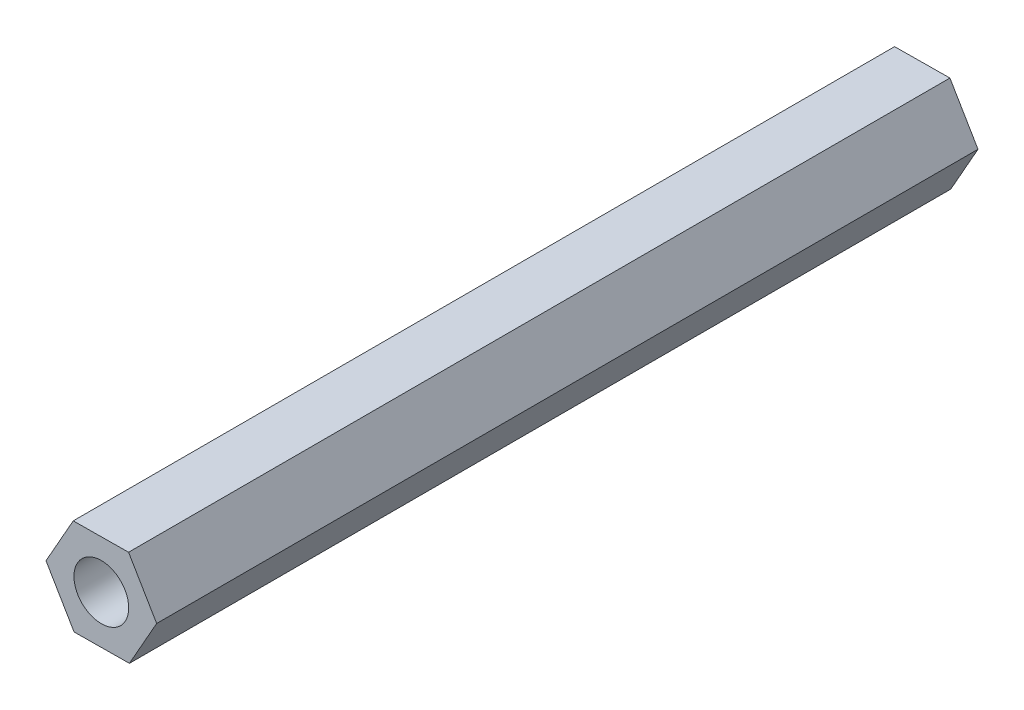
from build123d import *

# Parameters (mm, degrees)
SKETCH_1_R      = 2
EXTRUDE_1_DEPTH = 60


with BuildPart() as part:
    # 草图1 → 凸台-拉伸1 (new body)
    with BuildSketch(Plane.XY):
        Polygon((2.051456248, -3.482077052), (4.041295309, 0.035574699), (1.989839061, 3.517651751), (-2.051456248, 3.482077052), (-4.041295309, -0.035574699), (-1.989839061, -3.517651751), align=None)
        Circle(SKETCH_1_R, mode=Mode.SUBTRACT)
    extrude(amount=EXTRUDE_1_DEPTH)


solid = part.part
